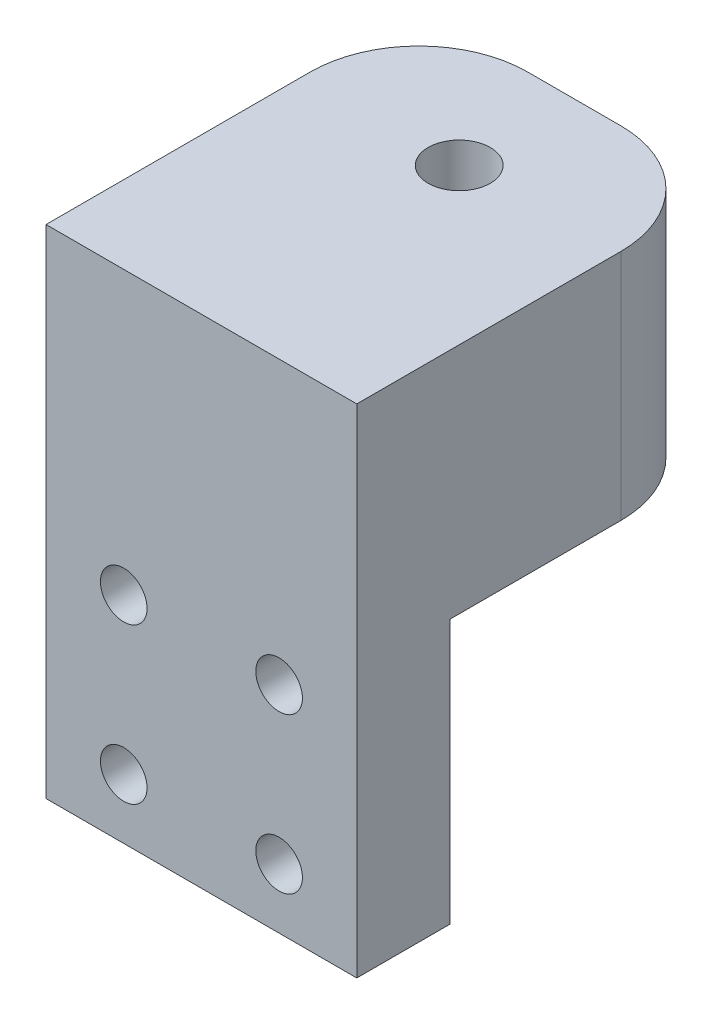
from build123d import *

# Parameters (mm, degrees)
SKETCH_1_W          = 20
SKETCH_1_H          = 20
SKETCH_1_R          = 1.5
EXTRUDE_1_DEPTH     = 6
SKETCH_2_W          = 20
SKETCH_2_H          = 3
EXTRUDE_2_DEPTH     = 18
SKETCH_3_W          = 20
SKETCH_3_H          = 24
EXTRUDE_3_DEPTH     = 12
CUT_EXTRUDE_1_DEPTH = 39.052595181


with BuildPart() as part:
    # Эскиз1 → Бобышка-Вытянуть1 (new body)
    with BuildSketch(Plane.XY):
        Rectangle(SKETCH_1_W, SKETCH_1_H)
        with Locations((-5, -6.152042824)):
            Circle(SKETCH_1_R, mode=Mode.SUBTRACT)
        with Locations((-5, 3.847957176)):
            Circle(SKETCH_1_R, mode=Mode.SUBTRACT)
        with Locations((5, 3.847957176)):
            Circle(SKETCH_1_R, mode=Mode.SUBTRACT)
        with Locations((5, -6.152042824)):
            Circle(SKETCH_1_R, mode=Mode.SUBTRACT)
    extrude(amount=EXTRUDE_1_DEPTH)

    # Эскиз2 → Бобышка-Вытянуть2 (add)
    with BuildSketch(Plane(origin=(0, 0, 0), x_dir=(-1, 0, 0), z_dir=(0, 0, -1))):
        with Locations((0, 8.5)):
            Rectangle(SKETCH_2_W, SKETCH_2_H)
    extrude(amount=EXTRUDE_2_DEPTH)

    # Эскиз3 → Бобышка-Вытянуть3 (add)
    with BuildSketch(Plane(origin=(0, 10, 0), x_dir=(1, 0, 0), z_dir=(0, 1, 0))):
        with Locations((0, 6)):
            Rectangle(SKETCH_3_W, SKETCH_3_H)
    extrude(amount=EXTRUDE_3_DEPTH)

    # Эскиз4 → Вырез-Вытянуть1 (cut, through all)
    with BuildSketch(Plane(origin=(0, 22, 0), x_dir=(1, 0, 0), z_dir=(0, 1, 0))):
        with BuildLine():
            Line((-10, 18), (-10, 11))
            ThreePointArc((-10, 11), (-7.949747468, 15.949747468), (-3, 18))
            Line((-3, 18), (-10, 18))
        make_face()
        with BuildLine():
            ThreePointArc((0, 12.591020059), (-2, 10.591020059), (0, 8.591020059))
            Line((0, 8.591020059), (0, 12.591020059))
        make_face()
        with BuildLine():
            Line((0, 12.591020059), (0, 8.591020059))
            ThreePointArc((0, 8.591020059), (1.414213562, 9.176806496), (2, 10.591020059))
            ThreePointArc((2, 10.591020059), (1.414213562, 12.005233621), (0, 12.591020059))
        make_face()
        with BuildLine():
            ThreePointArc((3, 18), (7.949747468, 15.949747468), (10, 11))
            Line((10, 11), (10, 18))
            Line((10, 18), (3, 18))
        make_face()
    extrude(amount=-CUT_EXTRUDE_1_DEPTH, mode=Mode.SUBTRACT)


solid = part.part
